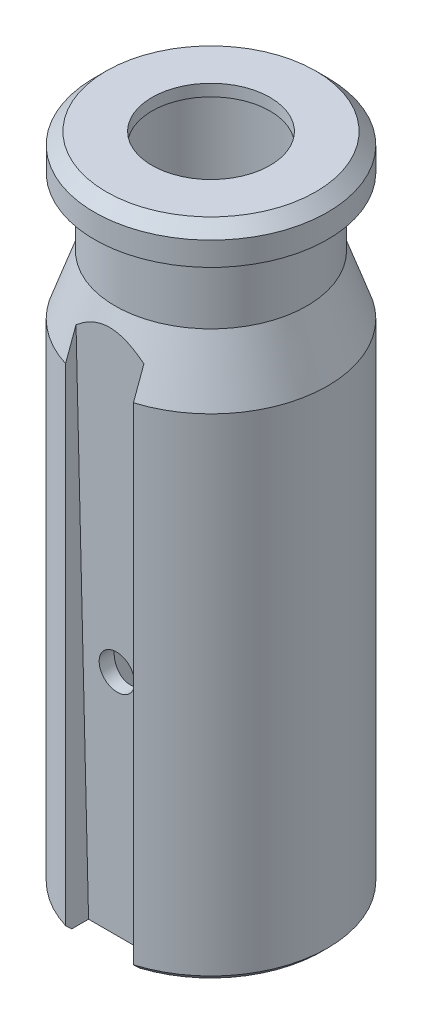
from build123d import *

# Parameters (mm, degrees)
LOCATING_HOLE_REACH      = 25.663
LOCATING_HOLE_END_RADIUS = 2.75
LOCATINGHOLES_R          = 0.6


with BuildPart() as part:
    # MainBodyS → MAIN BODY (revolve)
    with BuildSketch(Plane.XY, mode=Mode.PRIVATE) as main_body_sk:
        Polygon((3.95, 0.2), (3.95, 16.7), (3.25, 18.7), (3.25, 21), (3.95, 21), (3.95, 21.8), (3.55, 22.2), (2, 22.2), (2, 21.8), (2.75, 21.8), (2.75, 4), (1.3, 4), (1.3, 0), (3.75, 0), align=None)
    revolve(main_body_sk.sketch.rotate(Axis((0, 0, 0), (0, 1, 0)), 90), axis=Axis((0, 0, 0), (0, 1, 0)))

    # LoftedSlotEndS → LOFTED SLOT section 0
    with BuildSketch(Plane(origin=(0, 18.7, 0), x_dir=(-1, 0, 0), z_dir=(0, -1, 0))):
        with BuildLine():
            Line((-1.15, 3.95), (1.15, 3.95))
            Line((1.15, 3.95), (1.15, 3.45))
            Line((1.15, 3.45), (-1.15, 3.45))
            Line((-1.15, 3.45), (-1.15, 3.95))
        make_face()
    # LoftedSlotStartS → LOFTED SLOT section 1
    with BuildSketch(Plane(origin=(0, 0, 0), x_dir=(-1, 0, 0), z_dir=(0, -1, 0))):
        with BuildLine():
            Line((-1.15, 3.95), (1.15, 3.95))
            Line((1.15, 3.95), (1.15, 3))
            Line((1.15, 3), (-1.15, 3))
            Line((-1.15, 3), (-1.15, 3.95))
        make_face()
    lofted_slot = loft(mode=Mode.SUBTRACT)

    # LS HM: LOFTED SLOT across plane
    add(lofted_slot.mirror(Plane.XY), mode=Mode.SUBTRACT)

    # LOCATING HOLE: up to this cylinder (the profile starts outside it)
    locating_hole_end = Plane(origin=(0, 7.925534, 0), z_dir=(0, -1, 0)) * Cylinder(LOCATING_HOLE_END_RADIUS, 57.826, mode=Mode.PRIVATE)
    # LocatingHoleS → LOCATING HOLE (cut, up to the surface)
    with BuildSketch(Plane(origin=(0, -0.072150732, 2.998263752), x_dir=(1, 0, 0), z_dir=(0, -0.024057206555424756, 0.999710583525427)), mode=Mode.PRIVATE) as locating_hole_sk1:
        with Locations(Location((0, 8, 0), (0, 0, 270))):
            Circle(LOCATINGHOLES_R)
    locating_hole_tool1 = extrude(locating_hole_sk1.sketch, amount=-LOCATING_HOLE_REACH, mode=Mode.PRIVATE) - locating_hole_end
    add(locating_hole_tool1.solids().sort_by_distance((0, 7.925534, 3.190721))[0], mode=Mode.SUBTRACT)


solid = part.part
